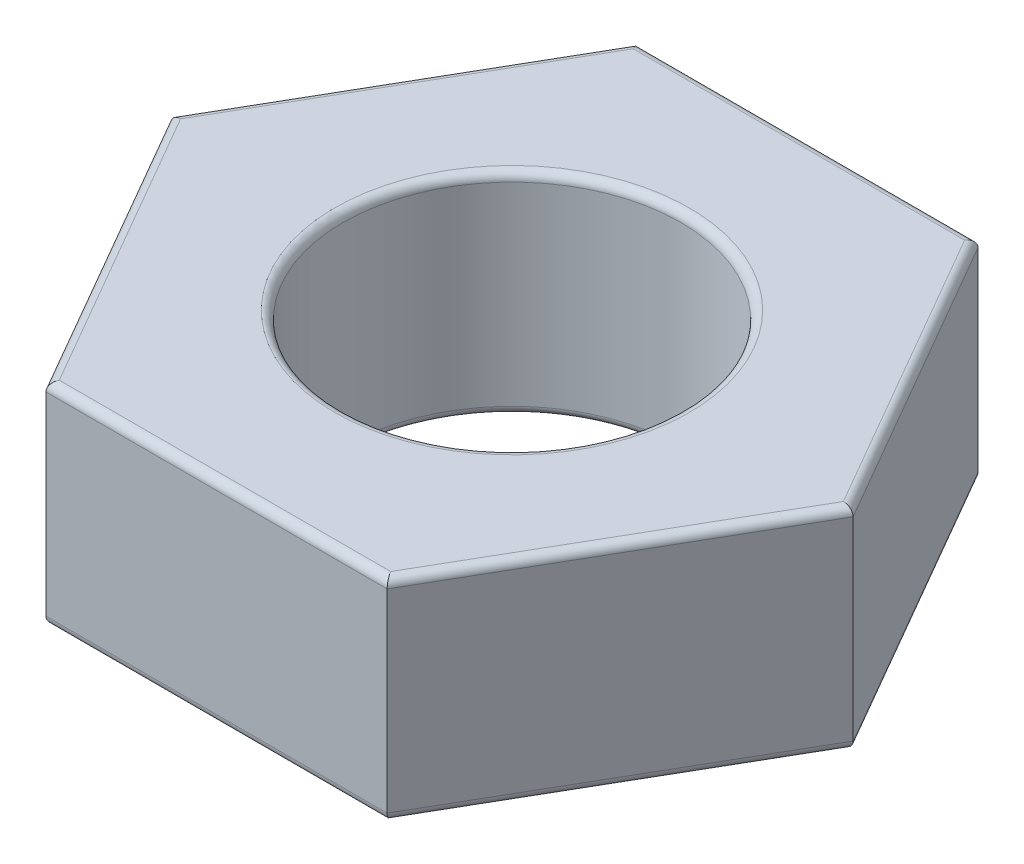
from build123d import *

# Parameters (mm, degrees)
SKETCH1_R           = 2
BOSS_EXTRUDE1_DEPTH = 2.5
FILLET1_R           = 0.1


with BuildPart() as part:
    # Sketch1 → Boss-Extrude1 (new body)
    with BuildSketch(Plane(origin=(0, 0, 0), x_dir=(1, 0, 0), z_dir=(0, 1, 0))):
        Polygon((2.020725942, -3.5), (4.041451884, 0), (2.020725942, 3.5), (-2.020725942, 3.5), (-4.041451884, 0), (-2.020725942, -3.5), align=None)
        with Locations(Location((0, 0, 0), (0, 0, 270))):
            Circle(SKETCH1_R, mode=Mode.SUBTRACT)
    extrude(amount=BOSS_EXTRUDE1_DEPTH)

    # Fillet1
    fillet1_edges = [part.edges().sort_by_distance(p)[0] for p in [
        (3.031088913, 2.5, -1.75),
        (0, 2.5, -3.5),
        (-3.031088913, 2.5, -1.75),
        (0, 0, -2),
        (0, 2.5, -2),
        (-3.031088913, 2.5, 1.75),
        (0, 2.5, 3.5),
        (-3.031088913, 0, 1.75),
        (-3.031088913, 0, -1.75),
        (0, 0, -3.5),
        (3.031088913, 2.5, 1.75),
        (3.031088913, 0, -1.75),
        (3.031088913, 0, 1.75),
        (0, 0, 3.5),
    ]]
    fillet(fillet1_edges, radius=FILLET1_R)


solid = part.part
